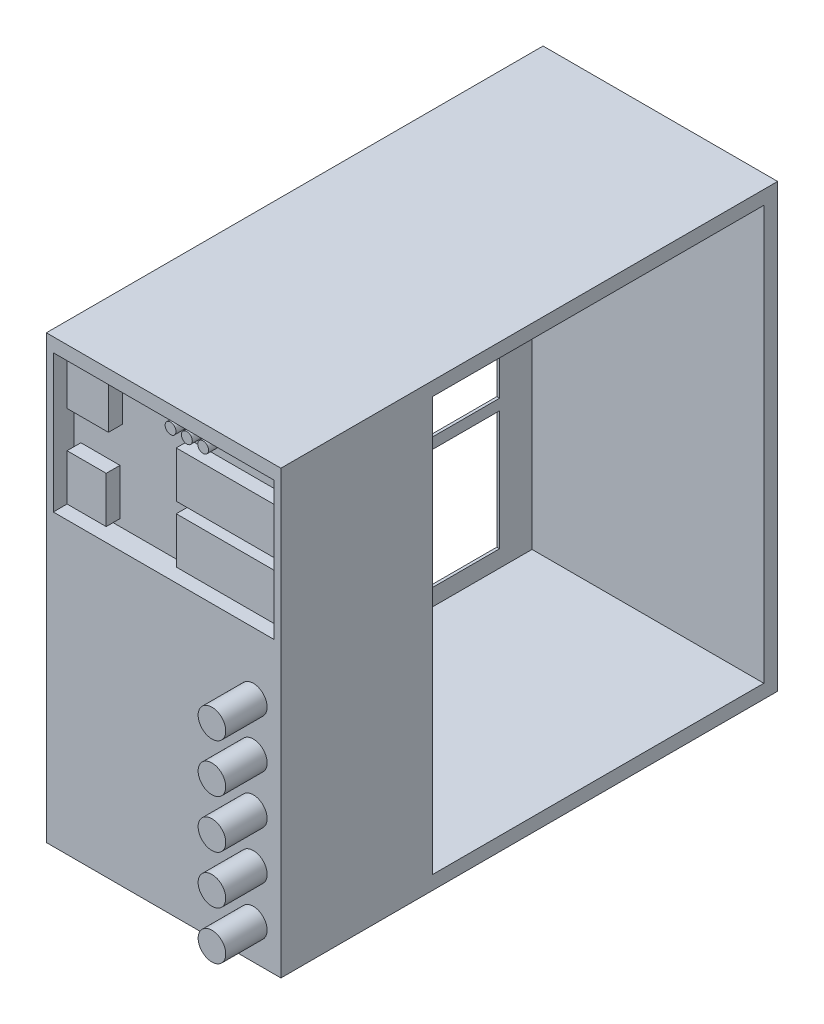
from build123d import *

# Parameters (mm, degrees)
SKETCH2_W           = 431.8
SKETCH2_H           = 812.8
BOSS_EXTRUDE1_DEPTH = 457.2
SKETCH3_W           = 406.4
SKETCH3_H           = 254
CUT_EXTRUDE1_DEPTH  = 38.1
SKETCH3_4_R         = 25.4
BOSS_EXTRUDE2_DEPTH = 76.2
SKETCH5_R           = 10
SKETCH5_W           = 76.2
SKETCH5_H           = 76.2
SKETCH5_W_2         = 180
SKETCH5_H_2         = 85
SKETCH5_W_3         = 72
BOSS_EXTRUDE3_DEPTH = 25.4
SKETCH6_W           = 609.6
SKETCH6_H           = 762
CUT_EXTRUDE2_DEPTH  = 798.57617818
SKETCH7_W           = 5.08
SKETCH7_H           = 762
BOSS_EXTRUDE4_DEPTH = 609.6
SKETCH8_W           = 609.6
SKETCH8_H           = 762
CUT_EXTRUDE3_DEPTH  = 798.57617818
SKETCH9_W           = 5.08
SKETCH9_H           = 762
BOSS_EXTRUDE5_DEPTH = 609.6
SKETCH10_W          = 220
SKETCH10_H          = 220
CUT_EXTRUDE5_DEPTH  = 25.4


with BuildPart() as part:
    # Sketch2 → Boss-Extrude1 (new, symmetric)
    with BuildSketch(Plane.XY):
        Rectangle(SKETCH2_W, SKETCH2_H)
    extrude(amount=BOSS_EXTRUDE1_DEPTH, both=True)

    # Sketch3 → Cut-Extrude1 (cut)
    with BuildSketch(Plane.XY.offset(457.2)):
        with Locations((0, 254)):
            Rectangle(SKETCH3_W, SKETCH3_H)
    extrude(amount=-CUT_EXTRUDE1_DEPTH, mode=Mode.SUBTRACT)

    # Sketch3<4> → Boss-Extrude2 (add)
    with BuildSketch(Plane.XY.offset(457.2)):
        with Locations(Location((165.1, -342.9, 0), (0, 0, 180))):
            Circle(SKETCH3_4_R)
        with Locations(Location((165.1, -254, 0), (0, 0, 180))):
            Circle(SKETCH3_4_R)
        with Locations(Location((165.1, -165.1, 0), (0, 0, 180))):
            Circle(SKETCH3_4_R)
        with Locations(Location((165.1, -76.2, 0), (0, 0, 180))):
            Circle(SKETCH3_4_R)
        with Locations(Location((165.1, 12.7, 0), (0, 0, 180))):
            Circle(SKETCH3_4_R)
    extrude(amount=BOSS_EXTRUDE2_DEPTH)

    # Sketch5 → Boss-Extrude3 (add)
    with BuildSketch(Plane.XY.offset(419.1)):
        with Locations((0, 355.6)):
            Circle(SKETCH5_R)
        with Locations((30, 355.6)):
            Circle(SKETCH5_R)
        with Locations((60, 355.6)):
            Circle(SKETCH5_R)
        with Locations((-152.4, 330.2)):
            Rectangle(SKETCH5_W, SKETCH5_H)
        with Locations((100.5, 182.2)):
            Rectangle(SKETCH5_W_2, SKETCH5_H_2)
        with Locations((100.5, 287.2)):
            Rectangle(SKETCH5_W_2, SKETCH5_H_2)
        with Locations((-154.5, 182.2)):
            Rectangle(SKETCH5_W_3, SKETCH5_H_2)
    extrude(amount=BOSS_EXTRUDE3_DEPTH)

    # Sketch6 → Cut-Extrude2 (cut, through all)
    with BuildSketch(Plane(origin=(215.9, 0, 0), x_dir=(0, 0, -1), z_dir=(1, 0, 0))):
        with Locations((127, 0)):
            Rectangle(SKETCH6_W, SKETCH6_H)
    extrude(amount=-CUT_EXTRUDE2_DEPTH, mode=Mode.SUBTRACT)

    # Sketch7 → Boss-Extrude4 (add)
    with BuildSketch(Plane.XY.offset(-431.8)):
        with Locations((213.36, 0)):
            Rectangle(SKETCH7_W, SKETCH7_H)
    extrude(amount=BOSS_EXTRUDE4_DEPTH)

    # Sketch8 → Cut-Extrude3 (cut, through all)
    with BuildSketch(Plane(origin=(215.9, 0, 0), x_dir=(0, 0, -1), z_dir=(1, 0, 0))):
        with Locations((127, 0)):
            Rectangle(SKETCH8_W, SKETCH8_H)
    extrude(amount=-CUT_EXTRUDE3_DEPTH, mode=Mode.SUBTRACT)

    # Sketch9 → Boss-Extrude5 (add)
    with BuildSketch(Plane.XY.offset(-431.8)):
        with Locations((-213.36, 0)):
            Rectangle(SKETCH9_W, SKETCH9_H)
    extrude(amount=BOSS_EXTRUDE5_DEPTH)

    # Sketch10 → Cut-Extrude5 (cut)
    with BuildSketch(Plane.ZY.offset(215.9)):
        with Locations((-262, 240)):
            Rectangle(SKETCH10_W, SKETCH10_H)
        with Locations((-262, 0)):
            Rectangle(SKETCH10_W, SKETCH10_H)
        with Locations((-262, -240)):
            Rectangle(SKETCH10_W, SKETCH10_H)
        with Locations((8, -240)):
            Rectangle(SKETCH10_W, SKETCH10_H)
        with Locations((8, 240)):
            Rectangle(SKETCH10_W, SKETCH10_H)
        with Locations((8, 0)):
            Rectangle(SKETCH10_W, SKETCH10_H)
    extrude(amount=-CUT_EXTRUDE5_DEPTH, mode=Mode.SUBTRACT)


solid = part.part
